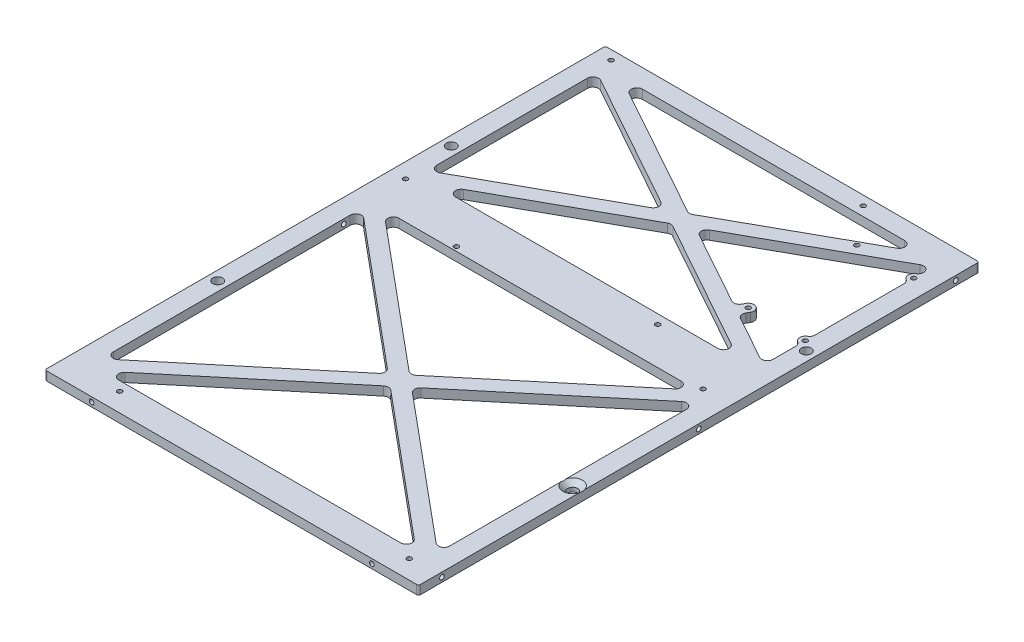
from build123d import *

# Parameters (mm, degrees)
SKETCH1_W                      = 200
SKETCH1_H                      = 300
BOSS_EXTRUDE1_DEPTH            = 4.7625
CUT_EXTRUDE1_DEPTH             = 181.340459704
SKETCH15_R                     = 3.5
BOSS_EXTRUDE2_DEPTH            = 4.7625
M3X0_5_TAPPED_HOLE3_D          = 2.5
M5_CLEARANCE_HOLE1_D           = 5.3
FILLET2_R                      = 3
M3X0_5_TAPPED_HOLE4_AT_2_COUNT = 2
M3X0_5_TAPPED_HOLE4_AT_2_PITCH = 150
M3X0_5_TAPPED_HOLE5_AT_2_COUNT = 2
M3X0_5_TAPPED_HOLE5_AT_2_PITCH = 137.5
M3X0_5_TAPPED_HOLE5_AT_3_COUNT = 2
M3X0_5_TAPPED_HOLE5_AT_3_PITCH = 275
FILLET1_R                      = 1


with BuildPart() as part:
    # Sketch1 → Boss-Extrude1 (new body)
    with BuildSketch(Plane(origin=(0, 0, 0), x_dir=(1, 0, 0), z_dir=(0, 1, 0))):
        Rectangle(SKETCH1_W, SKETCH1_H)
    extrude(amount=BOSS_EXTRUDE1_DEPTH)

    # Sketch14 → Cut-Extrude1 (cut, through all)
    with BuildSketch(Plane(origin=(0, 4.7625, 0), x_dir=(1, 0, 0), z_dir=(0, 1, 0))):
        Polygon((-83.751800259, 15), (83.751800259, 15), (0, -54.793166883), align=None)
        Polygon((90, 9.793166883), (90, -129.793166883), (6.248199741, -60), align=None)
        Polygon((83.751800259, -135), (-83.751800259, -135), (0, -65.206833117), align=None)
        Polygon((-90, -129.793166883), (-90, 9.793166883), (-6.248199741, -60), align=None)
        with BuildLine():
            Line((8.236504113, 90), (90, 135.424164382))
            Line((90, 135.424164382), (90, 128))
            ThreePointArc((90, 128), (87, 125), (90, 122))
            Line((90, 122), (90, 70))
            ThreePointArc((90, 70), (87, 67), (90, 64))
            Line((90, 64), (90, 44.575835618))
            Line((90, 44.575835618), (59.796175629, 61.355738047))
            Line((59.796175629, 61.355738047), (62.122471828, 65.543071206))
            ThreePointArc((62.122471828, 65.543071206), (60.956928794, 69.622471828), (56.877528172, 68.456928794))
            Line((56.877528172, 68.456928794), (54.551231972, 64.269595634))
            Line((54.551231972, 64.269595634), (8.236504113, 90))
        make_face()
        Polygon((81.763495887, 140), (0, 94.575835618), (-81.763495887, 140), align=None)
        Polygon((-90, 135.424164382), (-8.236504113, 90), (-90, 44.575835618), align=None)
        Polygon((-81.763495887, 40), (0, 85.424164382), (81.763495887, 40), align=None)
    extrude(amount=-CUT_EXTRUDE1_DEPTH, mode=Mode.SUBTRACT)

    # Sketch15 → Boss-Extrude2 (add)
    with BuildSketch(Plane(origin=(0, 4.7625, 0), x_dir=(1, 0, 0), z_dir=(0, 1, 0))):
        with Locations((85, -140)):
            Circle(SKETCH15_R)
    extrude(amount=-BOSS_EXTRUDE2_DEPTH)

    # M3x0.5 Tapped Hole3 (through all)
    with Locations(Plane(origin=(0, 4.7625, 0), x_dir=(1, 0, 0), z_dir=(0, 1, 0))):
        with Locations((85, 17.25), (-47, 17.25), (85, -140), (-70, -140), (-92, 145), (-92, 35), (43, 35), (43, 145), (59.5, 67), (90, 67), (90, 125), (59.5, 125)):
            Hole(M3X0_5_TAPPED_HOLE3_D / 2)

    # M5 Clearance Hole1 (through all)
    with Locations(Plane(origin=(0, 4.7625, 0), x_dir=(1, 0, 0), z_dir=(0, 1, 0))):
        with Locations((-95, 62.5), (-95, -62.5), (95, -62.5), (95, 62.5)):
            Hole(M5_CLEARANCE_HOLE1_D / 2)

    # Sketch29 → CSK for M5 Flat Head Machine Screw1 (revolve, cut)
    with BuildSketch(Plane(origin=(95, 4.7625, 62.5), x_dir=(0, 0, 1), z_dir=(1, 0, 0))):
        Polygon((0, 0), (0, 4.7625), (2.65, 4.7625), (2.65, 2.55), (5.2, 0), align=None)
    revolve(axis=Axis((95, 11.1125, 62.5), (0, -1, 0)), mode=Mode.SUBTRACT)

    # Fillet2
    fillet2_edges = [part.edges().sort_by_distance(p)[0] for p in [
        (6.248199741, 2.38125, 60),
        (90, 2.38125, -9.793166883),
        (90, 2.38125, 129.793166883),
        (54.551231972, 2.38125, -64.269595634),
        (8.236504113, 2.38125, -90),
        (90, 2.38125, -135.424164382),
        (90, 2.38125, -128),
        (90, 2.38125, -122),
        (90, 2.38125, -70),
        (90, 2.38125, -64),
        (90, 2.38125, -44.575835618),
        (59.796175629, 2.38125, -61.355738047),
        (-6.248199741, 2.38125, 60),
        (-90, 2.38125, 129.793166883),
        (-90, 2.38125, -9.793166883),
        (0, 2.38125, 54.793166883),
        (-83.751800259, 2.38125, -15),
        (83.751800259, 2.38125, -15),
        (0, 2.38125, 65.206833117),
        (83.751800259, 2.38125, 135),
        (-83.751800259, 2.38125, 135),
        (81.763495887, 2.38125, -40),
        (-81.763495887, 2.38125, -40),
        (0, 2.38125, -85.424164382),
        (-90, 2.38125, -44.575835618),
        (-90, 2.38125, -135.424164382),
        (-8.236504113, 2.38125, -90),
        (-81.763495887, 2.38125, -140),
        (81.763495887, 2.38125, -140),
        (0, 2.38125, -94.575835618),
    ]]
    fillet(fillet2_edges, radius=FILLET2_R)

    # Sketch22 → M3x0.5 Tapped Hole4 (revolve, cut)
    with BuildSketch(Plane(origin=(-75, 2.38125, 150), x_dir=(0, -1, 0), z_dir=(1, 0, 0))):
        Polygon((0, 0), (0, 10.751075774), (1.25, 10), (1.25, 0), align=None)
    m3x0_5_tapped_hole4 = revolve(axis=Axis((-75, 2.38125, 156.35), (0, 0, -1)), mode=Mode.SUBTRACT)

    # M3x0.5 Tapped Hole4 at 2: M3x0.5 Tapped Hole4 ×2
    with Locations(*[(i * M3X0_5_TAPPED_HOLE4_AT_2_PITCH, 0, 0) for i in range(1, M3X0_5_TAPPED_HOLE4_AT_2_COUNT)]):
        add(m3x0_5_tapped_hole4, mode=Mode.SUBTRACT)

    # Mirror1: M3x0.5 Tapped Hole4 across plane
    add(m3x0_5_tapped_hole4.mirror(Plane.XY), mode=Mode.SUBTRACT)

    # Mirror1 copy 1 sketch → Mirror1 copy 1 (revolve, cut)
    with BuildSketch(Plane(origin=(75, 2.38125, -150), x_dir=(0, -1, 0), z_dir=(1, 0, 0))):
        Polygon((0, 0), (0, -10.751075774), (1.25, -10), (1.25, 0), align=None)
    revolve(axis=Axis((75, 2.38125, -156.35), (0, 0, -1)), mode=Mode.SUBTRACT)

    # Sketch25 → M3x0.5 Tapped Hole5 (revolve, cut)
    with BuildSketch(Plane(origin=(-100, 2.38125, -137.5), x_dir=(0, 0, 1), z_dir=(0, 1, 0))):
        Polygon((0, 0), (0, 10.751075774), (1.25, 10), (1.25, 0), align=None)
    m3x0_5_tapped_hole5 = revolve(axis=Axis((-106.35, 2.38125, -137.5), (1, 0, 0)), mode=Mode.SUBTRACT)

    # M3x0.5 Tapped Hole5 at 2: M3x0.5 Tapped Hole5 ×2
    with Locations(*[(0, 0, i * M3X0_5_TAPPED_HOLE5_AT_2_PITCH) for i in range(1, M3X0_5_TAPPED_HOLE5_AT_2_COUNT)]):
        add(m3x0_5_tapped_hole5, mode=Mode.SUBTRACT)

    # M3x0.5 Tapped Hole5 at 3: M3x0.5 Tapped Hole5 ×2
    with Locations(*[(0, 0, i * M3X0_5_TAPPED_HOLE5_AT_3_PITCH) for i in range(1, M3X0_5_TAPPED_HOLE5_AT_3_COUNT)]):
        add(m3x0_5_tapped_hole5, mode=Mode.SUBTRACT)

    # Mirror2: M3x0.5 Tapped Hole5 across plane
    add(m3x0_5_tapped_hole5.mirror(Plane(origin=(0, 0, 0), x_dir=(0, 0, 1), z_dir=(1, 0, 0))), mode=Mode.SUBTRACT)

    # Mirror2 copy 1 sketch → Mirror2 copy 1 (revolve, cut)
    with BuildSketch(Plane(origin=(100, 2.38125, 0), x_dir=(0, 0, 1), z_dir=(0, 1, 0))):
        Polygon((0, 0), (0, -10.751075774), (1.25, -10), (1.25, 0), align=None)
    revolve(axis=Axis((106.35, 2.38125, 0), (1, 0, 0)), mode=Mode.SUBTRACT)

    # Mirror2 copy 2 sketch → Mirror2 copy 2 (revolve, cut)
    with BuildSketch(Plane(origin=(100, 2.38125, 137.5), x_dir=(0, 0, 1), z_dir=(0, 1, 0))):
        Polygon((0, 0), (0, -10.751075774), (1.25, -10), (1.25, 0), align=None)
    revolve(axis=Axis((106.35, 2.38125, 137.5), (1, 0, 0)), mode=Mode.SUBTRACT)

    # Fillet1
    fillet1_edges = [part.edges().sort_by_distance(p)[0] for p in [
        (100, 2.38125, 150),
        (-100, 2.38125, 150),
        (-100, 2.38125, -150),
        (100, 2.38125, -150),
    ]]
    fillet(fillet1_edges, radius=FILLET1_R)


solid = part.part
